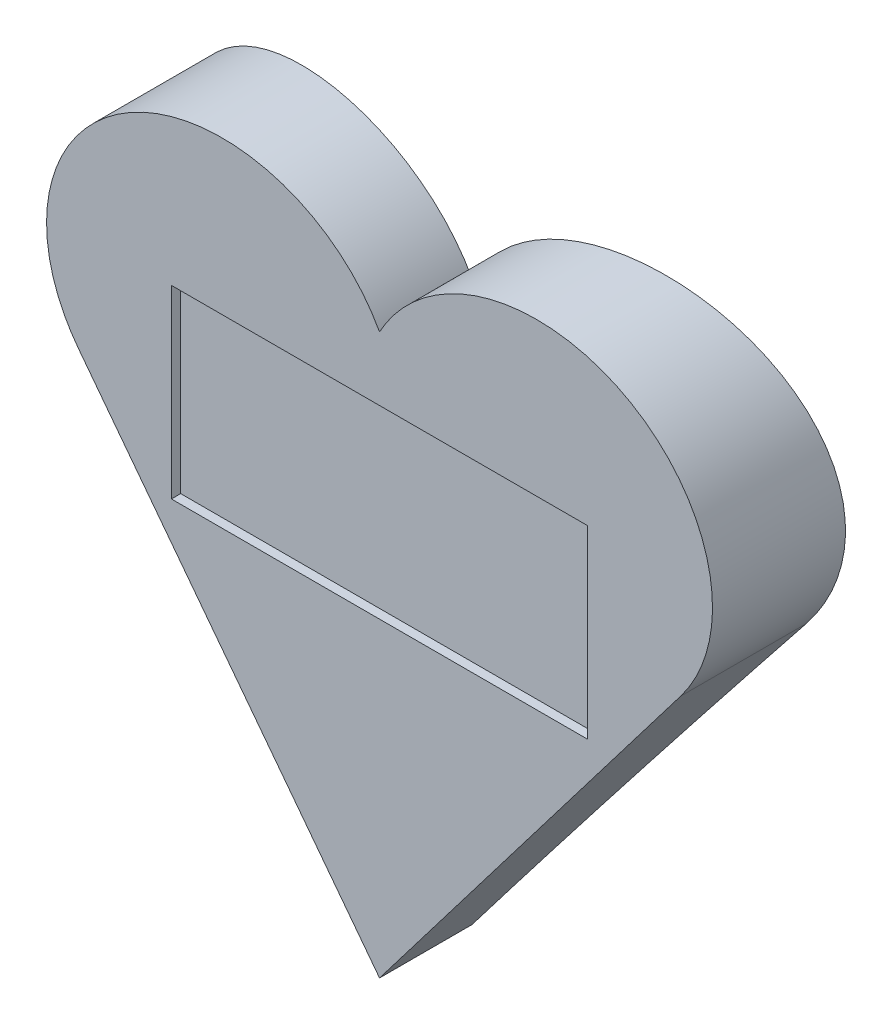
from build123d import *

# Parameters (mm, degrees)
SKETCH1_R                       = 15.01
BOSS_EXTRUDE1_DEPTH             = 10
BOSS_EXTRUDE5_REACH             = 37.021
BOSS_EXTRUDE5_END_RADIUS        = 15.01
BOSS_EXTRUDE5_DIRECTION_2_DEPTH = 1
SKETCH1_6_R                     = 15.01
CUT_EXTRUDE4_DEPTH              = 10
SKETCH10_W                      = 4.5
SKETCH10_H                      = 2
CUT_EXTRUDE5_DEPTH              = 0.1
SCALE1_SCALE                    = 2


with BuildPart() as part:
    # Sketch1 → Boss-Extrude1 (new, symmetric)
    with BuildSketch(Plane(origin=(0, 0, 0), x_dir=(1, 0, 0), z_dir=(0, 1, 0))):
        with Locations(Location((0, 0, 0), (0, 0, 270))):
            Circle(SKETCH1_R)
    extrude(amount=BOSS_EXTRUDE1_DEPTH, both=True)

    # Boss-Extrude5: up to this cylinder (the profile starts outside it)
    boss_extrude5_end = Plane(origin=(0, 0.800577, 0), z_dir=(0, -1, 0)) * Cylinder(BOSS_EXTRUDE5_END_RADIUS, 105.062, mode=Mode.PRIVATE)
    # Sketch4 → Boss-Extrude5 (add, up to the surface)
    with BuildSketch(Plane.XY.offset(15.01), mode=Mode.PRIVATE) as boss_extrude5_sk1:
        with BuildLine():
            Line((-3.255620582, 0.743633484), (0, -3.52322366))
            Line((0, -3.52322366), (3.255620582, 0.743633484))
            add(Edge.make_bspline(
                [(3.255620582, 0.743633484), (4.430741967, 2.2837623), (2.672393252, 3.2464719), (0.914044538, 4.2091815), (0, 2.52611108)],
                knots=[2.530022773, 2.530022773, 2.530022773, 4.175126676, 4.175126676, 5.820230579, 5.820230579, 5.820230579], degree=2, weights=[1, 0.680353139, 1, 0.680353139, 1]))
            add(Edge.make_bspline(
                [(0, 2.52611108), (-0.914044538, 4.2091815), (-2.672393252, 3.2464719), (-4.430741967, 2.2837623), (-3.255620582, 0.743633484)],
                knots=[3.604547382, 3.604547382, 3.604547382, 5.249651284, 5.249651284, 6.894755187, 6.894755187, 6.894755187], degree=2, weights=[1, 0.680353139, 1, 0.680353139, 1]))
        make_face()
    boss_extrude5_tool1 = extrude(boss_extrude5_sk1.sketch, amount=-BOSS_EXTRUDE5_REACH, mode=Mode.PRIVATE) - boss_extrude5_end
    add(boss_extrude5_tool1.solids().sort_by_distance((0, 0.800577, 15.01))[0])
    add(boss_extrude5_tool1.solids().sort_by_distance((0, 0.800577, 15.01))[1])

    # Sketch4 → Boss-Extrude5 direction 2 (add)
    with BuildSketch(Plane.XY.offset(15.01)):
        with BuildLine():
            Line((-3.255620582, 0.743633484), (0, -3.52322366))
            Line((0, -3.52322366), (3.255620582, 0.743633484))
            add(Edge.make_bspline(
                [(3.255620582, 0.743633484), (4.430741967, 2.2837623), (2.672393252, 3.2464719), (0.914044538, 4.2091815), (0, 2.52611108)],
                knots=[2.530022773, 2.530022773, 2.530022773, 4.175126676, 4.175126676, 5.820230579, 5.820230579, 5.820230579], degree=2, weights=[1, 0.680353139, 1, 0.680353139, 1]))
            add(Edge.make_bspline(
                [(0, 2.52611108), (-0.914044538, 4.2091815), (-2.672393252, 3.2464719), (-4.430741967, 2.2837623), (-3.255620582, 0.743633484)],
                knots=[3.604547382, 3.604547382, 3.604547382, 5.249651284, 5.249651284, 6.894755187, 6.894755187, 6.894755187], degree=2, weights=[1, 0.680353139, 1, 0.680353139, 1]))
        make_face()
    extrude(amount=BOSS_EXTRUDE5_DIRECTION_2_DEPTH)

    # Sketch1<6> → Cut-Extrude4 (cut, symmetric)
    with BuildSketch(Plane(origin=(0, 0, 0), x_dir=(1, 0, 0), z_dir=(0, 1, 0))):
        Circle(SKETCH1_6_R)
    extrude(amount=CUT_EXTRUDE4_DEPTH, both=True, mode=Mode.SUBTRACT)

    # Sketch10 → Cut-Extrude5 (cut)
    with BuildSketch(Plane.XY.offset(16.01)):
        with Locations((0, 0.837122437)):
            Rectangle(SKETCH10_W, SKETCH10_H)
    extrude(amount=-CUT_EXTRUDE5_DEPTH, mode=Mode.SUBTRACT)


with BuildPart() as part_1:
    # Scale1: scaled about (-0.000142983, 0.855339948, 15.44144862)
    add(part.part.scale(SCALE1_SCALE).moved(Location((0.000142983, -0.855339948, -15.44144862))))


solid = part_1.part
